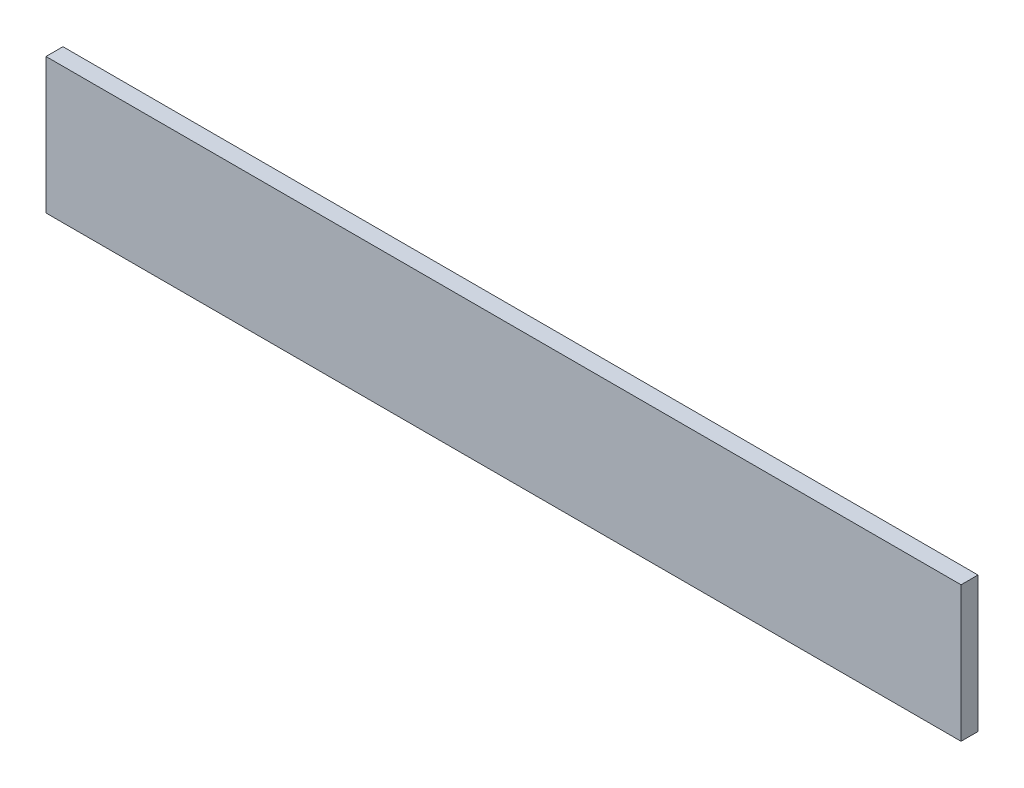
from build123d import *

# Parameters (mm, degrees)
ESQUISSE1_W             = 270
ESQUISSE1_H             = 180
BOSS_EXTRU_1_DEPTH      = 5
ESQUISSE2_W             = 270
ESQUISSE2_H             = 5
ENL_V_MAT_EXTRU_1_DEPTH = 140


with BuildPart() as part:
    # Esquisse1 → Boss.-Extru.1 (new body)
    with BuildSketch(Plane.XY):
        Rectangle(ESQUISSE1_W, ESQUISSE1_H)
    extrude(amount=BOSS_EXTRU_1_DEPTH)

    # Esquisse2 → Enlèv. mat.-Extru.1 (cut)
    with BuildSketch(Plane(origin=(0, 90, 0), x_dir=(1, 0, 0), z_dir=(0, 1, 0))):
        with Locations((0, -2.5)):
            Rectangle(ESQUISSE2_W, ESQUISSE2_H)
    extrude(amount=-ENL_V_MAT_EXTRU_1_DEPTH, mode=Mode.SUBTRACT)


solid = part.part
